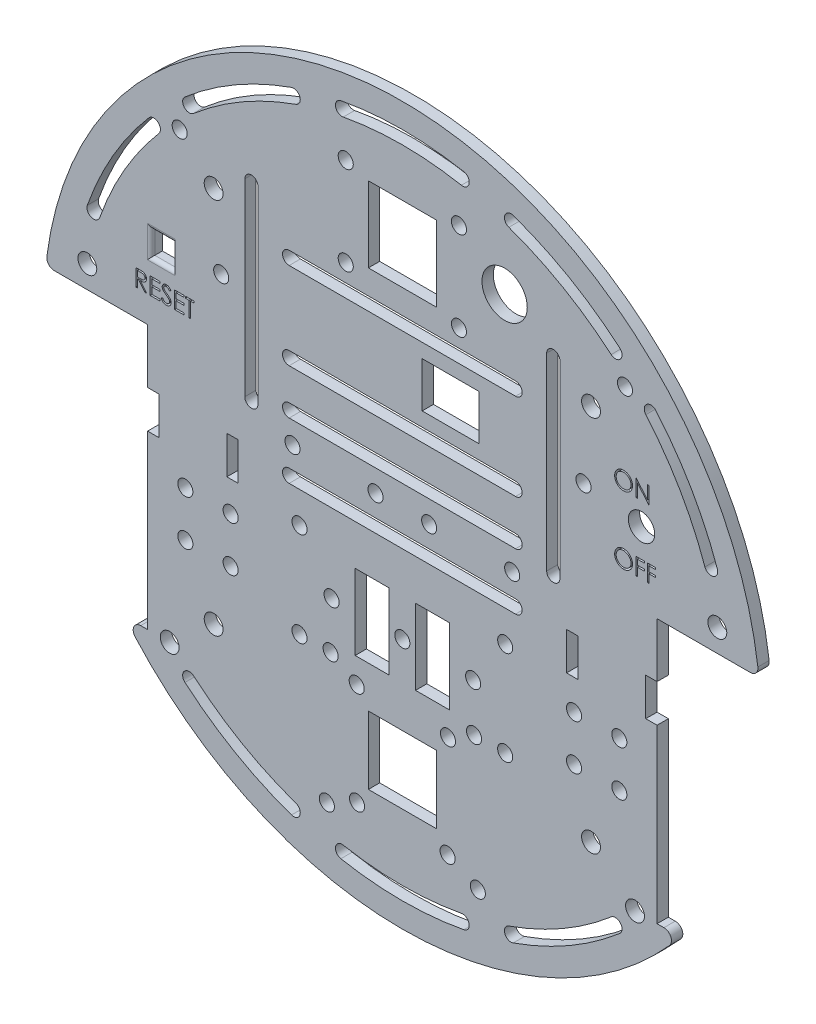
from build123d import *

# Parameters (mm, degrees)
CROQUIS1_R              = 2
CROQUIS1_R_2            = 2.5
CROQUIS1_R_3            = 3.5
CROQUIS1_R_4            = 6
CROQUIS1_W              = 9
CROQUIS1_H              = 20
CROQUIS1_W_2            = 18
CROQUIS1_H_2            = 18
CROQUIS1_W_3            = 3
CROQUIS1_H_3            = 10
CROQUIS1_W_4            = 15
CROQUIS1_H_4            = 12
CROQUIS1_W_5            = 6.4
CROQUIS1_H_5            = 6.4
SALIENTE_EXTRUIR1_DEPTH = 3
REDONDEO2_R             = 2
CORTAR_EXTRUIR2_DEPTH   = 2
REDONDEO3_R             = 1


with BuildPart() as part:
    # Croquis1 → Saliente-Extruir1 (new body)
    with BuildSketch(Plane.XY):
        with BuildLine():
            Line((-73.654599313, -60), (-67.5, -60))
            Line((-67.5, -60), (-67.5, -14.445595459))
            Line((-67.5, -14.445595459), (-64.5, -14.445595459))
            Line((-64.5, -14.445595459), (-64.5, -4.445595459))
            Line((-64.5, -4.445595459), (-67.5, -4.445595459))
            Line((-67.5, -4.445595459), (-67.5, 10))
            Line((-67.5, 10), (-94.472218138, 10))
            ThreePointArc((-94.472218138, 10), (0, 95), (94.472218138, 10))
            Line((94.472218138, 10), (67.5, 10))
            Line((67.5, 10), (67.5, -4.445595459))
            Line((67.5, -4.445595459), (64.5, -4.445595459))
            Line((64.5, -4.445595459), (64.5, -14.445595459))
            Line((64.5, -14.445595459), (67.5, -14.445595459))
            Line((67.5, -14.445595459), (67.5, -60))
            Line((67.5, -60), (73.654599313, -60))
            ThreePointArc((73.654599313, -60), (0, -95), (-73.654599313, -60))
        make_face()
        with Locations((-57.5, -22.445595459)):
            Circle(CROQUIS1_R, mode=Mode.SUBTRACT)
        with Locations((-45.5, -22.445595459)):
            Circle(CROQUIS1_R, mode=Mode.SUBTRACT)
        with Locations(Location((-45.5, -34.445595459, 0), (0, 0, 180))):
            Circle(CROQUIS1_R, mode=Mode.SUBTRACT)
        with Locations(Location((-57.5, -34.445595459, 0), (0, 0, 180))):
            Circle(CROQUIS1_R, mode=Mode.SUBTRACT)
        with Locations((-15, 50.5)):
            Circle(CROQUIS1_R, mode=Mode.SUBTRACT)
        with Locations((-15, 74)):
            Circle(CROQUIS1_R, mode=Mode.SUBTRACT)
        with Locations(Location((45.5, -22.445595459, 0), (0, 0, 180))):
            Circle(CROQUIS1_R, mode=Mode.SUBTRACT)
        with Locations((45.5, -34.445595459)):
            Circle(CROQUIS1_R, mode=Mode.SUBTRACT)
        with Locations((57.5, -34.445595459)):
            Circle(CROQUIS1_R, mode=Mode.SUBTRACT)
        with Locations(Location((57.5, -22.445595459, 0), (0, 0, 180))):
            Circle(CROQUIS1_R, mode=Mode.SUBTRACT)
        with Locations((0, -28.445595459)):
            Circle(CROQUIS1_R, mode=Mode.SUBTRACT)
        with Locations(Location((15, 50.5, 0), (0, 0, 180))):
            Circle(CROQUIS1_R, mode=Mode.SUBTRACT)
        with Locations(Location((15, 74, 0), (0, 0, 180))):
            Circle(CROQUIS1_R, mode=Mode.SUBTRACT)
        with Locations((-50, 50)):
            Circle(CROQUIS1_R_2, mode=Mode.SUBTRACT)
        with Locations((-27.25, -15.945595459)):
            Circle(CROQUIS1_R, mode=Mode.SUBTRACT)
        with Locations(Location((-27.25, -40.945595459, 0), (0, 0, 180))):
            Circle(CROQUIS1_R, mode=Mode.SUBTRACT)
        with Locations((27.25, -40.945595459)):
            Circle(CROQUIS1_R, mode=Mode.SUBTRACT)
        with Locations(Location((27.25, -15.945595459, 0), (0, 0, 180))):
            Circle(CROQUIS1_R, mode=Mode.SUBTRACT)
        with Locations(Location((-50, -50, 0), (0, 0, 180))):
            Circle(CROQUIS1_R_2, mode=Mode.SUBTRACT)
        with Locations((50, -50)):
            Circle(CROQUIS1_R_2, mode=Mode.SUBTRACT)
        with Locations(Location((50, 50, 0), (0, 0, 180))):
            Circle(CROQUIS1_R_2, mode=Mode.SUBTRACT)
        with Locations((63.3826689, 29.044256368)):
            Circle(CROQUIS1_R_3, mode=Mode.SUBTRACT)
        with Locations((-83.472218138, 16)):
            Circle(CROQUIS1_R_2, mode=Mode.SUBTRACT)
        with Locations(Location((83.472218138, 16, 0), (0, 0, 180))):
            Circle(CROQUIS1_R_2, mode=Mode.SUBTRACT)
        with Locations((-61.654599313, -60)):
            Circle(CROQUIS1_R_2, mode=Mode.SUBTRACT)
        with Locations(Location((61.654599313, -60, 0), (0, 0, 180))):
            Circle(CROQUIS1_R_2, mode=Mode.SUBTRACT)
        with Locations((-48, 31.316031132)):
            Circle(CROQUIS1_R, mode=Mode.SUBTRACT)
        with Locations(Location((48, 31.316031132, 0), (0, 0, 180))):
            Circle(CROQUIS1_R, mode=Mode.SUBTRACT)
        with Locations((-20, -75.931306828)):
            Circle(CROQUIS1_R, mode=Mode.SUBTRACT)
        with Locations((-19, -40.945595459)):
            Circle(CROQUIS1_R, mode=Mode.SUBTRACT)
        with Locations(Location((19, -40.945595459, 0), (0, 0, 180))):
            Circle(CROQUIS1_R, mode=Mode.SUBTRACT)
        with Locations(Location((20, -75.931306828, 0), (0, 0, 180))):
            Circle(CROQUIS1_R, mode=Mode.SUBTRACT)
        with Locations((-12, -71.931306828)):
            Circle(CROQUIS1_R, mode=Mode.SUBTRACT)
        with Locations((-12.092592593, -44.931306828)):
            Circle(CROQUIS1_R, mode=Mode.SUBTRACT)
        with Locations(Location((12, -71.931306828, 0), (0, 0, 180))):
            Circle(CROQUIS1_R, mode=Mode.SUBTRACT)
        with Locations(Location((12.092592593, -44.931306828, 0), (0, 0, 180))):
            Circle(CROQUIS1_R, mode=Mode.SUBTRACT)
        with Locations((18.75, -28.445595459)):
            Circle(CROQUIS1_R, mode=Mode.SUBTRACT)
        with Locations(Location((-18.75, -28.445595459, 0), (0, 0, 180))):
            Circle(CROQUIS1_R, mode=Mode.SUBTRACT)
        with Locations((-29.105454469, 1.554404541)):
            Circle(CROQUIS1_R, mode=Mode.SUBTRACT)
        with Locations((-7.105571497, 1.482646437)):
            Circle(CROQUIS1_R, mode=Mode.SUBTRACT)
        with Locations(Location((7.105571497, 1.482646437, 0), (0, 0, 180))):
            Circle(CROQUIS1_R, mode=Mode.SUBTRACT)
        with Locations(Location((29.105454469, 1.554404541, 0), (0, 0, 180))):
            Circle(CROQUIS1_R, mode=Mode.SUBTRACT)
        with Locations((27.101290916, 64.25)):
            Circle(CROQUIS1_R_4, mode=Mode.SUBTRACT)
        with Locations((-59, 59)):
            Circle(CROQUIS1_R, mode=Mode.SUBTRACT)
        with Locations(Location((59, 59, 0), (0, 0, 180))):
            Circle(CROQUIS1_R, mode=Mode.SUBTRACT)
        with Locations((8, -28.445595459)):
            Rectangle(CROQUIS1_W, CROQUIS1_H, mode=Mode.SUBTRACT)
        with Locations((-8, -28.445595459)):
            Rectangle(CROQUIS1_W, CROQUIS1_H, mode=Mode.SUBTRACT)
        with Locations((0, 62.25)):
            Rectangle(CROQUIS1_W_2, CROQUIS1_H, mode=Mode.SUBTRACT)
        with BuildLine():
            Line((-30, -7.695595459), (30, -7.695595459))
            ThreePointArc((30, -7.695595459), (31.75, -5.945595459), (30, -4.195595459))
            Line((30, -4.195595459), (-30, -4.195595459))
            ThreePointArc((-30, -4.195595459), (-31.75, -5.945595459), (-30, -7.695595459))
        make_face(mode=Mode.SUBTRACT)
        with Locations((0, -58.431306828)):
            Rectangle(CROQUIS1_W_2, CROQUIS1_H_2, mode=Mode.SUBTRACT)
        with BuildLine():
            Line((-41.75, 6.316031132), (-41.75, 56.316031132))
            ThreePointArc((-41.75, 56.316031132), (-40, 58.066031132), (-38.25, 56.316031132))
            Line((-38.25, 56.316031132), (-38.25, 6.316031132))
            ThreePointArc((-38.25, 6.316031132), (-40, 4.566031132), (-41.75, 6.316031132))
        make_face(mode=Mode.SUBTRACT)
        with BuildLine():
            Line((41.75, 6.316031132), (41.75, 56.316031132))
            ThreePointArc((41.75, 56.316031132), (40, 58.066031132), (38.25, 56.316031132))
            Line((38.25, 56.316031132), (38.25, 6.316031132))
            ThreePointArc((38.25, 6.316031132), (40, 4.566031132), (41.75, 6.316031132))
        make_face(mode=Mode.SUBTRACT)
        with BuildLine():
            Line((-30, 10.804404541), (30, 10.804404541))
            ThreePointArc((30, 10.804404541), (31.75, 9.054404541), (30, 7.304404541))
            Line((30, 7.304404541), (-30, 7.304404541))
            ThreePointArc((-30, 7.304404541), (-31.75, 9.054404541), (-30, 10.804404541))
        make_face(mode=Mode.SUBTRACT)
        with BuildLine():
            Line((-30, 45.804404541), (30, 45.804404541))
            ThreePointArc((30, 45.804404541), (31.75, 44.054404541), (30, 42.304404541))
            Line((30, 42.304404541), (-30, 42.304404541))
            ThreePointArc((-30, 42.304404541), (-31.75, 44.054404541), (-30, 45.804404541))
        make_face(mode=Mode.SUBTRACT)
        with Locations((-45, -9.445595459)):
            Rectangle(CROQUIS1_W_3, CROQUIS1_H_3, mode=Mode.SUBTRACT)
        with Locations((45, -9.445595459)):
            Rectangle(CROQUIS1_W_3, CROQUIS1_H_3, mode=Mode.SUBTRACT)
        with BuildLine():
            Line((-30, 22.804404541), (30, 22.804404541))
            ThreePointArc((30, 22.804404541), (31.75, 21.054404541), (30, 19.304404541))
            Line((30, 19.304404541), (-30, 19.304404541))
            ThreePointArc((-30, 19.304404541), (-31.75, 21.054404541), (-30, 22.804404541))
        make_face(mode=Mode.SUBTRACT)
        with Locations((12.75, 32.554404541)):
            Rectangle(CROQUIS1_W_4, CROQUIS1_H_4, mode=Mode.SUBTRACT)
        with Locations((-63.3826689, 29.044256368)):
            Rectangle(CROQUIS1_W_5, CROQUIS1_H_5, mode=Mode.SUBTRACT)
        with BuildLine():
            ThreePointArc((-16.298168859, -86.986318992), (0, -88.5), (16.298168859, -86.986318992))
            ThreePointArc((16.298168859, -86.986318992), (17.692755137, -84.943083897), (15.650734057, -83.546720603))
            ThreePointArc((15.650734057, -83.546720603), (0, -85), (-15.650734057, -83.546720603))
            ThreePointArc((-15.650734057, -83.546720603), (-17.692755137, -84.943083897), (-16.298168859, -86.986318992))
        make_face(mode=Mode.SUBTRACT)
        with BuildLine():
            ThreePointArc((-57.607787764, -67.183277599), (-44.25, -76.643248235), (-29.378531229, -83.481446459))
            ThreePointArc((-29.378531229, -83.481446459), (-27.149166537, -82.409246099), (-28.21942702, -80.178949474))
            ThreePointArc((-28.21942702, -80.178949474), (-42.5, -73.612159322), (-55.327293583, -64.528215416))
            ThreePointArc((-55.327293583, -64.528215416), (-57.79391736, -64.716490962), (-57.607787764, -67.183277599))
        make_face(mode=Mode.SUBTRACT)
        with BuildLine():
            ThreePointArc((-67.183277599, 57.607787764), (-76.643248235, 44.25), (-83.481446459, 29.378531229))
            ThreePointArc((-83.481446459, 29.378531229), (-82.409246099, 27.149166537), (-80.178949474, 28.21942702))
            ThreePointArc((-80.178949474, 28.21942702), (-73.612159322, 42.5), (-64.528215416, 55.327293583))
            ThreePointArc((-64.528215416, 55.327293583), (-64.716490962, 57.79391736), (-67.183277599, 57.607787764))
        make_face(mode=Mode.SUBTRACT)
        with BuildLine():
            ThreePointArc((-29.378531229, 83.481446459), (-44.25, 76.643248235), (-57.607787764, 67.183277599))
            ThreePointArc((-57.607787764, 67.183277599), (-57.79391736, 64.716490962), (-55.327293583, 64.528215416))
            ThreePointArc((-55.327293583, 64.528215416), (-42.5, 73.612159322), (-28.21942702, 80.178949474))
            ThreePointArc((-28.21942702, 80.178949474), (-27.149166537, 82.409246099), (-29.378531229, 83.481446459))
        make_face(mode=Mode.SUBTRACT)
        with BuildLine():
            ThreePointArc((57.607787764, 67.183277599), (44.25, 76.643248235), (29.378531229, 83.481446459))
            ThreePointArc((29.378531229, 83.481446459), (27.149166537, 82.409246099), (28.21942702, 80.178949474))
            ThreePointArc((28.21942702, 80.178949474), (42.5, 73.612159322), (55.327293583, 64.528215416))
            ThreePointArc((55.327293583, 64.528215416), (57.79391736, 64.716490962), (57.607787764, 67.183277599))
        make_face(mode=Mode.SUBTRACT)
        with BuildLine():
            ThreePointArc((83.481446459, 29.378531229), (76.643248235, 44.25), (67.183277599, 57.607787764))
            ThreePointArc((67.183277599, 57.607787764), (64.716490962, 57.79391736), (64.528215416, 55.327293583))
            ThreePointArc((64.528215416, 55.327293583), (73.612159322, 42.5), (80.178949474, 28.21942702))
            ThreePointArc((80.178949474, 28.21942702), (82.409246099, 27.149166537), (83.481446459, 29.378531229))
        make_face(mode=Mode.SUBTRACT)
        with BuildLine():
            ThreePointArc((29.378531229, -83.481446459), (44.25, -76.643248235), (57.607787764, -67.183277599))
            ThreePointArc((57.607787764, -67.183277599), (57.79391736, -64.716490962), (55.327293583, -64.528215416))
            ThreePointArc((55.327293583, -64.528215416), (42.5, -73.612159322), (28.21942702, -80.178949474))
            ThreePointArc((28.21942702, -80.178949474), (27.149166537, -82.409246099), (29.378531229, -83.481446459))
        make_face(mode=Mode.SUBTRACT)
        with BuildLine():
            ThreePointArc((-15.650734057, 83.546720603), (0, 85), (15.650734057, 83.546720603))
            ThreePointArc((15.650734057, 83.546720603), (17.692755137, 84.943083897), (16.298168859, 86.986318992))
            ThreePointArc((16.298168859, 86.986318992), (0, 88.5), (-16.298168859, 86.986318992))
            ThreePointArc((-16.298168859, 86.986318992), (-17.692755137, 84.943083897), (-15.650734057, 83.546720603))
        make_face(mode=Mode.SUBTRACT)
    extrude(amount=SALIENTE_EXTRUIR1_DEPTH)

    # Redondeo2
    redondeo2_edges = [part.edges().sort_by_distance(p)[0] for p in [
        (-73.654599313, -60, 1.5),
        (-94.472218138, 10, 1.5),
        (94.472218138, 10, 1.5),
        (73.654599313, -60, 1.5),
    ]]
    fillet(redondeo2_edges, radius=REDONDEO2_R)

    # Croquis2 → Cortar-Extruir2 (cut)
    # profile 1 of 10: a face of its own
    with BuildSketch(Plane.XY.offset(3)):
        with BuildLine():
            add(Edge.make_bspline(
                [(58.598863743, 39.621904175), (58.682188451, 39.619793701), (58.845845051, 39.615648557), (59.08636992, 39.583918281), (59.315992185, 39.529024209), (59.536582364, 39.45591466), (59.745501905, 39.358387593), (59.944323338, 39.240506688), (60.132573604, 39.101036955), (60.307715381, 38.941056521), (60.467988603, 38.76699208), (60.609193313, 38.581234767), (60.727533405, 38.384907735), (60.824715132, 38.178600953), (60.900956201, 37.962780994), (60.9535664, 37.736297276), (60.987172593, 37.500617246), (60.99110145, 37.33986842), (60.993094513, 37.258322444)],
                knots=[0, 0, 0, 0, 1.065120563, 2.091984664, 3.0946048, 4.079830382, 5.057816894, 6.036188127, 7.030412546, 8.04752943, 9.064399622, 10.05169764, 11.02544977, 11.989514704, 12.962713494, 13.945757189, 14.957906945, 16, 16, 16, 16], degree=3))
            add(Edge.make_bspline(
                [(60.993094513, 37.258322444), (60.991101742, 37.177377156), (60.987173761, 37.017824615), (60.95352819, 36.783640187), (60.90076119, 36.558523577), (60.825423133, 36.342850595), (60.728704661, 36.136393728), (60.609576584, 35.939696215), (60.46925217, 35.752693575), (60.309557647, 35.577434434), (60.135470593, 35.4167234), (59.948745964, 35.276684845), (59.753583125, 35.1561824), (59.547470643, 35.060031962), (59.333142024, 34.98318235), (59.108679037, 34.930786111), (58.875133468, 34.896988484), (58.715870748, 34.893107535), (58.634921436, 34.891134944)],
                knots=[0, 0, 0, 0, 1.043624062, 2.057103931, 3.04512605, 4.022047818, 4.998200453, 5.980619268, 6.982898556, 8.009068085, 9.034988726, 10.034168286, 11.015286542, 11.987931943, 12.962482838, 13.94673481, 14.956375938, 16, 16, 16, 16], degree=3))
            add(Edge.make_bspline(
                [(58.634921436, 34.891134944), (58.553375883, 34.893127013), (58.392627891, 34.897053911), (58.156651702, 34.930715717), (57.930008889, 34.983354536), (57.71334758, 35.058580954), (57.506546956, 35.155803108), (57.309202564, 35.274351595), (57.122106518, 35.41501792), (56.946809987, 35.574660659), (56.786418161, 35.748452654), (56.646584677, 35.934668125), (56.528009532, 36.129653712), (56.431113819, 36.333950529), (56.354402371, 36.546570955), (56.302067605, 36.768933283), (56.268207095, 36.999769791), (56.264305149, 37.156939231), (56.262325282, 37.236687829)],
                knots=[0, 0, 0, 0, 1.053102029, 2.075944431, 3.073151272, 4.055350789, 5.033113405, 6.020478099, 7.024410459, 8.052272461, 9.079885166, 10.07527673, 11.055994387, 12.023226415, 12.992069828, 13.970394897, 14.97016774, 16, 16, 16, 16], degree=3))
            add(Edge.make_bspline(
                [(56.262325282, 37.236687829), (56.26301267, 37.290215546), (56.264378776, 37.396595705), (56.280825237, 37.554567048), (56.304690282, 37.709997894), (56.338892741, 37.862446255), (56.383624884, 38.01153895), (56.436406062, 38.158304217), (56.500871578, 38.301254719), (56.573746696, 38.441067651), (56.655083307, 38.57556353), (56.744923556, 38.702694422), (56.840111887, 38.823527132), (56.944464822, 38.934930423), (57.054543108, 39.040145124), (57.172132452, 39.137554332), (57.296515337, 39.228036412), (57.428226968, 39.30957685), (57.564021893, 39.383324309), (57.704006322, 39.446609546), (57.846279057, 39.500925911), (57.991506461, 39.544949829), (58.139302882, 39.579705304), (58.289990891, 39.603371901), (58.443450439, 39.61986031), (58.546836421, 39.621219955), (58.598863743, 39.621904175)],
                knots=[0, 0, 0, 0, 1.037015668, 2.060948919, 3.074880161, 4.083647147, 5.086022904, 6.090072063, 7.104153813, 8.122640571, 9.144368836, 10.147691507, 11.138137339, 12.123020368, 13.103399296, 14.087645067, 15.080126199, 16.082011238, 17.087798457, 18.072939717, 19.057185487, 20.037253025, 21.01195951, 21.997135196, 22.992090687, 24, 24, 24, 24], degree=3))
        make_face()
        with BuildLine():
            add(Edge.make_bspline(
                [(58.618695474, 39.160365713), (58.575990945, 39.15984514), (58.490990146, 39.158808971), (58.364624313, 39.145160193), (58.239920399, 39.125707479), (58.116852647, 39.097959809), (57.995935989, 39.060154599), (57.876043336, 39.01664486), (57.758267982, 38.963646315), (57.642998736, 38.903767123), (57.531250782, 38.837489939), (57.42580588, 38.764240525), (57.326391052, 38.685736669), (57.233249709, 38.601795164), (57.146655345, 38.511988533), (57.064903586, 38.417678258), (56.991271267, 38.316168684), (56.923789811, 38.210212446), (56.863402588, 38.099947556), (56.809704274, 37.986534876), (56.76577912, 37.869049279), (56.729956065, 37.748765362), (56.700256308, 37.625873628), (56.681441263, 37.499441823), (56.667642515, 37.37010525), (56.666665571, 37.282700009), (56.666171436, 37.238490713)],
                knots=[0, 0, 0, 0, 1.008559885, 2.007477868, 2.99961109, 3.989939068, 4.984837346, 5.991145699, 7.001802488, 8.033829008, 9.059044045, 10.069351652, 11.065060232, 12.050310815, 13.029377138, 14.011219647, 14.996725999, 15.989392538, 16.977580475, 17.965360261, 18.951710183, 19.937753436, 20.929683414, 21.935841486, 22.955955122, 24, 24, 24, 24], degree=3))
            add(Edge.make_bspline(
                [(56.666171436, 37.238490713), (56.667810544, 37.173482144), (56.671035177, 37.045590176), (56.699266338, 36.858173991), (56.742751734, 36.67806048), (56.806854062, 36.506235168), (56.887019138, 36.34122109), (56.986053712, 36.184482099), (57.103386822, 36.035975832), (57.236668499, 35.896739057), (57.382369121, 35.769651595), (57.537082631, 35.658098641), (57.699151555, 35.563714034), (57.86899853, 35.486821798), (58.045716795, 35.425892135), (58.230445075, 35.384133895), (58.421952808, 35.356651167), (58.552492222, 35.354011909), (58.618695474, 35.352673406)],
                knots=[0, 0, 0, 0, 1.032063989, 2.030389145, 3.003944642, 3.970395727, 4.937377036, 5.913328081, 6.909231446, 7.93887556, 8.970685674, 9.976071282, 10.964166581, 11.944589148, 12.933237628, 13.927779006, 14.949070134, 16, 16, 16, 16], degree=3))
            add(Edge.make_bspline(
                [(58.618695474, 35.352673406), (58.663193405, 35.353284768), (58.751446166, 35.354497284), (58.882711837, 35.366709869), (59.011612681, 35.386293701), (59.137967898, 35.414490258), (59.261634084, 35.449779524), (59.383127402, 35.491703745), (59.501153776, 35.54400815), (59.617202139, 35.601798374), (59.728283021, 35.667678576), (59.834322991, 35.738441911), (59.932649251, 35.816830138), (60.025720914, 35.899524468), (60.1126708, 35.988192273), (60.192910922, 36.082718272), (60.266171092, 36.183699117), (60.333626924, 36.289494639), (60.393802547, 36.40006125), (60.446232817, 36.513885121), (60.490713538, 36.630685976), (60.526621615, 36.750632282), (60.554760066, 36.873496231), (60.574148535, 36.999442331), (60.587710813, 37.128218629), (60.588733055, 37.215317872), (60.589248359, 37.259223886)],
                knots=[0, 0, 0, 0, 1.047197238, 2.076906641, 3.100256066, 4.114471768, 5.12198147, 6.126382909, 7.136867548, 8.15857795, 9.17633901, 10.174870724, 11.156907918, 12.133735059, 13.104061851, 14.077631395, 15.04955518, 16.038496417, 17.029181396, 18.010275684, 18.986308667, 19.968651475, 20.955262928, 21.950658345, 22.966943676, 24, 24, 24, 24], degree=3))
            add(Edge.make_bspline(
                [(60.589248359, 37.259223886), (60.588732642, 37.302829535), (60.587709623, 37.389329371), (60.574155013, 37.517207566), (60.554739582, 37.642247409), (60.526758958, 37.763958013), (60.490694474, 37.882370402), (60.44622505, 37.997373364), (60.393786807, 38.109395329), (60.333604805, 38.218159425), (60.265955889, 38.322526945), (60.192034719, 38.422301476), (60.110564985, 38.515609286), (60.023874382, 38.604753892), (59.929797529, 38.687834036), (59.82876058, 38.764877277), (59.721990137, 38.837742915), (59.608940834, 38.903475781), (59.492270037, 38.964179794), (59.372552091, 39.016188227), (59.251143248, 39.060380952), (59.128352247, 39.098074192), (59.00314556, 39.125598803), (58.876369209, 39.145177724), (58.748198591, 39.15880422), (58.662000165, 39.159843564), (58.618695474, 39.160365713)],
                knots=[0, 0, 0, 0, 1.02996197, 2.043119294, 3.035359645, 4.018872909, 4.991431989, 5.957985074, 6.929999688, 7.912076566, 8.892894881, 9.867085534, 10.843653904, 11.817741046, 12.803660682, 13.806313499, 14.818574707, 15.856120519, 16.894564902, 17.924820532, 18.937903209, 19.946497019, 20.957711757, 21.963978472, 22.977135795, 24, 24, 24, 24], degree=3))
        make_face(mode=Mode.SUBTRACT)
    # profile 2 of 10: a face of its own
    with BuildSketch(Plane.XY.offset(3)):
        Polygon((61.916171436, 35.00651956), (61.916171436, 39.50651956), (62.000907013, 39.50651956), (64.973863743, 35.964752733), (64.973863743, 39.50651956), (65.377709897, 39.50651956), (65.377709897, 35.00651956), (65.285762782, 35.00651956), (62.32001759, 38.540173406), (62.32001759, 35.00651956), align=None)
    # profile 3 of 10: a face of its own
    with BuildSketch(Plane.XY.offset(3)):
        with BuildLine():
            Line((-70.609873728, 21.523755649), (-69.709332863, 21.523755649))
            add(Edge.make_bspline(
                [(-69.709332863, 21.523755649), (-69.649237126, 21.52355561), (-69.533846654, 21.523171512), (-69.368538164, 21.521029817), (-69.218331896, 21.51489136), (-69.083306389, 21.509608895), (-68.963464118, 21.499976399), (-68.858437601, 21.490769853), (-68.768710562, 21.478718004), (-68.714394467, 21.467525317), (-68.689801613, 21.462457572)],
                knots=[0, 0, 0, 0, 1.410062039, 2.707475311, 3.878576406, 4.937260626, 5.877586885, 6.699081471, 7.410979367, 8, 8, 8, 8], degree=3))
            add(Edge.make_bspline(
                [(-68.689801613, 21.462457572), (-68.65687881, 21.454323159), (-68.591735538, 21.438227863), (-68.497942596, 21.404208376), (-68.408567036, 21.364840288), (-68.323980119, 21.318601219), (-68.244605531, 21.26514793), (-68.169624846, 21.205403202), (-68.098697821, 21.139693937), (-68.034692868, 21.066363427), (-67.974342659, 20.989430771), (-67.923442996, 20.906240227), (-67.879566094, 20.819246834), (-67.844632572, 20.727565869), (-67.816503749, 20.632086448), (-67.796670012, 20.531943709), (-67.784775628, 20.427593884), (-67.783564671, 20.35641943), (-67.782950651, 20.320330168)],
                knots=[0, 0, 0, 0, 1.027469482, 2.033020251, 3.019912614, 3.986113645, 4.951240523, 5.91722682, 6.890402269, 7.87763091, 8.8651537, 9.85103654, 10.82876324, 11.815024772, 12.821070561, 13.842952187, 14.906261191, 16, 16, 16, 16], degree=3))
            add(Edge.make_bspline(
                [(-67.782950651, 20.320330168), (-67.784839363, 20.260370748), (-67.788524729, 20.143374389), (-67.822885576, 19.973581827), (-67.879169673, 19.815195566), (-67.956728188, 19.668415031), (-68.055496085, 19.536101344), (-68.174199388, 19.419885045), (-68.312904317, 19.322633728), (-68.442027723, 19.255194408), (-68.556088837, 19.212003526), (-68.649988811, 19.181613921), (-68.752417782, 19.158134252), (-68.862394355, 19.137099797), (-68.980376198, 19.121219047), (-69.106080534, 19.109587711), (-69.239597015, 19.10231822), (-69.331318675, 19.101235642), (-69.378503536, 19.100678726)],
                knots=[0, 0, 0, 0, 1.260483769, 2.459530307, 3.627416485, 4.787058657, 5.939039949, 7.08810263, 8.267026773, 9.491475466, 10.141966685, 10.831826277, 11.566392101, 12.351337768, 13.187381173, 14.07005841, 15.007169909, 16, 16, 16, 16], degree=3))
            Line((-69.378503536, 19.100678726), (-67.725258343, 17.023755649))
            Line((-67.725258343, 17.023755649), (-68.224657382, 17.023755649))
            Line((-68.224657382, 17.023755649), (-69.877902574, 19.100678726))
            Line((-69.877902574, 19.100678726), (-70.206027574, 19.100678726))
            Line((-70.206027574, 19.100678726), (-70.206027574, 17.023755649))
            Line((-70.206027574, 17.023755649), (-70.609873728, 17.023755649))
            Line((-70.609873728, 17.023755649), (-70.609873728, 21.523755649))
        make_face()
        with BuildLine():
            Line((-70.206027574, 21.062217187), (-70.206027574, 19.562217187))
            Line((-70.206027574, 19.562217187), (-69.382109305, 19.555907091))
            add(Edge.make_bspline(
                [(-69.382109305, 19.555907091), (-69.343640683, 19.555890073), (-69.269077539, 19.555857086), (-69.161205255, 19.560991941), (-69.060765112, 19.56683335), (-68.968141287, 19.575768223), (-68.883292405, 19.587283172), (-68.806260874, 19.601687009), (-68.73692095, 19.618468233), (-68.6560514, 19.644441752), (-68.565747289, 19.685592346), (-68.46760684, 19.745462273), (-68.384032406, 19.820765427), (-68.313423726, 19.906874156), (-68.256685885, 20.001549333), (-68.216684673, 20.103656093), (-68.191301532, 20.210616719), (-68.188307688, 20.284131429), (-68.186796805, 20.32123161)],
                knots=[0, 0, 0, 0, 1.146690395, 2.22261258, 3.21895312, 4.145990853, 4.996080663, 5.770904154, 6.481378293, 7.121626537, 8.300444488, 9.431385265, 10.535395872, 11.636531494, 12.74115979, 13.810798291, 14.895190096, 16, 16, 16, 16], degree=3))
            add(Edge.make_bspline(
                [(-68.186796805, 20.32123161), (-68.188342389, 20.357420062), (-68.191405173, 20.429132369), (-68.216410733, 20.53411854), (-68.25869708, 20.633204618), (-68.315682815, 20.725987528), (-68.3851103, 20.810209188), (-68.466518916, 20.882269813), (-68.557682738, 20.941733411), (-68.642888565, 20.9797319), (-68.719046838, 21.003028854), (-68.785170686, 21.019423208), (-68.859885444, 21.032594668), (-68.94355389, 21.043147889), (-69.035818844, 21.052218531), (-69.137146824, 21.058327961), (-69.246865542, 21.061945786), (-69.322911596, 21.062124615), (-69.362277574, 21.062217187)],
                knots=[0, 0, 0, 0, 1.101028733, 2.181837193, 3.264309656, 4.369019818, 5.486613113, 6.575447106, 7.666700264, 8.788928104, 9.402425223, 10.0903467, 10.862060571, 11.710948788, 12.657782767, 13.684531032, 14.801375019, 16, 16, 16, 16], degree=3))
            Line((-69.362277574, 21.062217187), (-70.206027574, 21.062217187))
        make_face(mode=Mode.SUBTRACT)
    # profile 4 of 10: a face of its own
    with BuildSketch(Plane.XY.offset(3)):
        Polygon((-66.80218142, 21.523755649), (-64.263719882, 21.523755649), (-64.263719882, 21.062217187), (-66.398335266, 21.062217187), (-66.398335266, 19.677601803), (-64.263719882, 19.677601803), (-64.263719882, 19.216063341), (-66.398335266, 19.216063341), (-66.398335266, 17.48529411), (-64.263719882, 17.48529411), (-64.263719882, 17.023755649), (-66.80218142, 17.023755649), align=None)
    # profile 5 of 10: a face of its own
    with BuildSketch(Plane.XY.offset(3)):
        with BuildLine():
            Line((-63.917566036, 17.891844591), (-63.537157382, 18.119909495))
            add(Edge.make_bspline(
                [(-63.537157382, 18.119909495), (-63.501776791, 18.060683857), (-63.433988944, 17.947209821), (-63.320908626, 17.793878055), (-63.20373774, 17.663555282), (-63.081608597, 17.556999643), (-62.955266663, 17.473108217), (-62.823887166, 17.413705348), (-62.687912838, 17.376656237), (-62.595375067, 17.372156126), (-62.549176613, 17.369909495)],
                knots=[0, 0, 0, 0, 1.272034388, 2.437168799, 3.508375237, 4.49857839, 5.41946034, 6.295179144, 7.148887113, 8, 8, 8, 8], degree=3))
            add(Edge.make_bspline(
                [(-62.549176613, 17.369909495), (-62.509722078, 17.37100836), (-62.431503369, 17.373186861), (-62.316351914, 17.394119321), (-62.204518168, 17.426277773), (-62.098307063, 17.472333256), (-61.99918413, 17.528054166), (-61.912261236, 17.595356394), (-61.837116233, 17.67070723), (-61.775647372, 17.754770644), (-61.728487326, 17.845178406), (-61.692240381, 17.937976058), (-61.672125286, 18.03462136), (-61.669095175, 18.099691955), (-61.667566036, 18.132529687)],
                knots=[0, 0, 0, 0, 1.095163259, 2.171163733, 3.241058638, 4.321873601, 5.38011039, 6.391990106, 7.366004449, 8.327778327, 9.272591725, 10.192022065, 11.087607919, 12, 12, 12, 12], degree=3))
            add(Edge.make_bspline(
                [(-61.667566036, 18.132529687), (-61.669461578, 18.169996494), (-61.673314938, 18.246161037), (-61.705883984, 18.35853202), (-61.75711873, 18.469736753), (-61.804384986, 18.538524094), (-61.828924209, 18.574236418)],
                knots=[0, 0, 0, 0, 0.938893495, 1.908633276, 2.914225137, 4, 4, 4, 4], degree=3))
            add(Edge.make_bspline(
                [(-61.828924209, 18.574236418), (-61.849072141, 18.600010906), (-61.891370205, 18.654121218), (-61.964087007, 18.734665092), (-62.049414868, 18.817745917), (-62.144433725, 18.906536133), (-62.252604839, 18.996906157), (-62.370540215, 19.093165371), (-62.50125089, 19.191653113), (-62.592921672, 19.257703555), (-62.640222286, 19.291784495)],
                knots=[0, 0, 0, 0, 0.722233717, 1.516239348, 2.393582979, 3.351407094, 4.387010283, 5.505090956, 6.712668013, 8, 8, 8, 8], degree=3))
            add(Edge.make_bspline(
                [(-62.640222286, 19.291784495), (-62.687567424, 19.325506965), (-62.778087722, 19.389981759), (-62.904677328, 19.485670124), (-63.017877352, 19.573155099), (-63.117184659, 19.653260258), (-63.202555569, 19.725996464), (-63.274662812, 19.790665243), (-63.331669528, 19.849015535), (-63.36336956, 19.886868689), (-63.377602093, 19.903863822)],
                knots=[0, 0, 0, 0, 1.452282411, 2.77665338, 3.964542531, 5.026858415, 5.96415736, 6.766646006, 7.446254459, 8, 8, 8, 8], degree=3))
            add(Edge.make_bspline(
                [(-63.377602093, 19.903863822), (-63.397495366, 19.930350869), (-63.436618156, 19.982441203), (-63.488260163, 20.063858877), (-63.532153372, 20.147203075), (-63.566562085, 20.232697758), (-63.595537223, 20.319142667), (-63.615025991, 20.407665697), (-63.627229216, 20.497869635), (-63.628478913, 20.558572707), (-63.629104497, 20.588959976)],
                knots=[0, 0, 0, 0, 1.068054152, 2.10047183, 3.106115577, 4.101338837, 5.06977816, 6.043150881, 7.020423561, 8, 8, 8, 8], degree=3))
            add(Edge.make_bspline(
                [(-63.629104497, 20.588959976), (-63.627426371, 20.636569686), (-63.624105988, 20.730771482), (-63.596025323, 20.86838255), (-63.551703031, 20.999765086), (-63.489609604, 21.123618373), (-63.409564436, 21.236717491), (-63.316933898, 21.340363403), (-63.206604844, 21.427494437), (-63.085551471, 21.503624226), (-62.953050421, 21.563211844), (-62.814204974, 21.608161676), (-62.668794453, 21.633630722), (-62.570304708, 21.637285705), (-62.520330459, 21.639140264)],
                knots=[0, 0, 0, 0, 1.005424448, 1.989358655, 2.955360095, 3.929531133, 4.905563448, 5.876582895, 6.856512386, 7.866279853, 8.892233794, 9.918561126, 10.94386622, 12, 12, 12, 12], degree=3))
            add(Edge.make_bspline(
                [(-62.520330459, 21.639140264), (-62.46730233, 21.637311269), (-62.361846306, 21.633673982), (-62.206725886, 21.602048585), (-62.057376394, 21.54971915), (-61.937235053, 21.490333732), (-61.843207217, 21.431021912), (-61.771499418, 21.376996424), (-61.698834124, 21.314799855), (-61.624625196, 21.244266539), (-61.550130063, 21.164749288), (-61.474242767, 21.076792688), (-61.39678585, 20.980934259), (-61.346956887, 20.912502758), (-61.321412189, 20.877421514)],
                knots=[0, 0, 0, 0, 1.286793592, 2.559021753, 3.825965368, 5.121522368, 5.803751409, 6.523245864, 7.299691795, 8.125521123, 9.008227632, 9.944561021, 10.946284179, 12, 12, 12, 12], degree=3))
            Line((-61.321412189, 20.877421514), (-61.686496324, 20.600678726))
            add(Edge.make_bspline(
                [(-61.686496324, 20.600678726), (-61.708541094, 20.629078471), (-61.750994168, 20.683769739), (-61.815446365, 20.760361431), (-61.876194627, 20.830325476), (-61.936045141, 20.891094926), (-61.991836953, 20.945997669), (-62.045987436, 20.99300307), (-62.097717316, 21.032571693), (-62.162924772, 21.074799127), (-62.244847553, 21.116657489), (-62.347684814, 21.152077732), (-62.455152882, 21.173362812), (-62.528348122, 21.176177096), (-62.565402574, 21.177601803)],
                knots=[0, 0, 0, 0, 1.181633172, 2.275549214, 3.290209073, 4.226197932, 5.078386478, 5.862611352, 6.581680152, 7.217281963, 8.414376989, 9.595101626, 10.782541182, 12, 12, 12, 12], degree=3))
            add(Edge.make_bspline(
                [(-62.565402574, 21.177601803), (-62.611889531, 21.176043903), (-62.70153525, 21.173039639), (-62.82880841, 21.14022823), (-62.943357742, 21.088565838), (-63.041782469, 21.016160866), (-63.123730011, 20.930376733), (-63.183008458, 20.831661062), (-63.218687241, 20.722655116), (-63.223041029, 20.646615843), (-63.225258343, 20.607890264)],
                knots=[0, 0, 0, 0, 1.14458467, 2.207223713, 3.21896685, 4.227309161, 5.202851033, 6.127160689, 7.046193047, 8, 8, 8, 8], degree=3))
            add(Edge.make_bspline(
                [(-63.225258343, 20.607890264), (-63.224752895, 20.58378122), (-63.223741171, 20.53552371), (-63.209630717, 20.464229024), (-63.191503008, 20.393114445), (-63.162776768, 20.322499696), (-63.12311852, 20.251149806), (-63.071040437, 20.177836143), (-63.005451893, 20.101912517), (-62.95521002, 20.052531608), (-62.928683824, 20.026459976)],
                knots=[0, 0, 0, 0, 0.858281714, 1.717966888, 2.583508476, 3.4729293, 4.427298488, 5.488583878, 6.674047936, 8, 8, 8, 8], degree=3))
            add(Edge.make_bspline(
                [(-62.928683824, 20.026459976), (-62.918833488, 20.017669514), (-62.895431345, 19.996785389), (-62.852648012, 19.962595314), (-62.796150128, 19.920420321), (-62.727413012, 19.868236628), (-62.645169262, 19.80770332), (-62.549409832, 19.73959439), (-62.441202147, 19.6616988), (-62.364416827, 19.607239105), (-62.323816036, 19.578443149)],
                knots=[0, 0, 0, 0, 0.420754252, 0.999615792, 1.744751191, 2.668019286, 3.750313428, 4.999500688, 6.413464383, 8, 8, 8, 8], degree=3))
            add(Edge.make_bspline(
                [(-62.323816036, 19.578443149), (-62.274977004, 19.542904258), (-62.180406989, 19.474088121), (-62.045847243, 19.370696533), (-61.923840919, 19.269577973), (-61.813959657, 19.171378193), (-61.715117917, 19.076842073), (-61.628412277, 18.98483227), (-61.552959259, 18.896007962), (-61.471728835, 18.782128936), (-61.388725924, 18.642267542), (-61.317443986, 18.470909807), (-61.27249754, 18.298885966), (-61.266619877, 18.183265748), (-61.263719882, 18.126219591)],
                knots=[0, 0, 0, 0, 1.163667725, 2.253281268, 3.268753668, 4.215851969, 5.092017293, 5.902905408, 6.650798638, 7.335211899, 8.59617414, 9.77448103, 10.901945474, 12, 12, 12, 12], degree=3))
            add(Edge.make_bspline(
                [(-61.263719882, 18.126219591), (-61.264564774, 18.085875979), (-61.26623815, 18.0059722), (-61.285473611, 17.888644244), (-61.313656037, 17.774690269), (-61.356132481, 17.665518838), (-61.407976542, 17.559132715), (-61.473761717, 17.458322557), (-61.550014455, 17.360857188), (-61.637486438, 17.269335556), (-61.733202599, 17.185319018), (-61.834367349, 17.110581654), (-61.941146271, 17.048265238), (-62.052960107, 16.997414155), (-62.16983454, 16.95764249), (-62.291730262, 16.928825944), (-62.418848205, 16.91114003), (-62.505248824, 16.909304336), (-62.549176613, 16.908371033)],
                knots=[0, 0, 0, 0, 0.983748083, 1.948392443, 2.894712957, 3.844097841, 4.80183111, 5.778335162, 6.776009319, 7.81870978, 8.863265674, 9.881300176, 10.883814829, 11.87499822, 12.874611388, 13.892143829, 14.928324115, 16, 16, 16, 16], degree=3))
            add(Edge.make_bspline(
                [(-62.549176613, 16.908371033), (-62.583164911, 16.909028267), (-62.650713459, 16.910334457), (-62.75062565, 16.921881817), (-62.848519408, 16.938219522), (-62.943166342, 16.964157612), (-63.035785871, 16.995628011), (-63.125975173, 17.034377296), (-63.213777956, 17.080813698), (-63.299686277, 17.133907301), (-63.383481644, 17.195695829), (-63.464378103, 17.267661753), (-63.545029913, 17.34782026), (-63.623056565, 17.438348127), (-63.700036322, 17.537782805), (-63.77445142, 17.647054612), (-63.8478422, 17.765568353), (-63.893890659, 17.84896632), (-63.917566036, 17.891844591)],
                knots=[0, 0, 0, 0, 0.915332311, 1.819136955, 2.706846663, 3.586547465, 4.459518054, 5.340707479, 6.227863349, 7.133153174, 8.059268498, 9.028702269, 10.047606654, 11.120612155, 12.245963614, 13.433783089, 14.680604001, 16, 16, 16, 16], degree=3))
        make_face()
    # profile 6 of 10: a face of its own
    with BuildSketch(Plane.XY.offset(3)):
        Polygon((-60.340642959, 21.523755649), (-57.80218142, 21.523755649), (-57.80218142, 21.062217187), (-59.936796805, 21.062217187), (-59.936796805, 19.677601803), (-57.80218142, 19.677601803), (-57.80218142, 19.216063341), (-59.936796805, 19.216063341), (-59.936796805, 17.48529411), (-57.80218142, 17.48529411), (-57.80218142, 17.023755649), (-60.340642959, 17.023755649), align=None)
    # profile 7 of 10: a face of its own
    with BuildSketch(Plane.XY.offset(3)):
        Polygon((-57.513719882, 21.062217187), (-57.513719882, 21.523755649), (-55.148335266, 21.523755649), (-55.148335266, 21.062217187), (-56.129104497, 21.062217187), (-56.129104497, 17.023755649), (-56.532950651, 17.023755649), (-56.532950651, 21.062217187), align=None)
    # profile 8 of 10: a face of its own
    with BuildSketch(Plane.XY.offset(3)):
        with BuildLine():
            add(Edge.make_bspline(
                [(58.598863743, 21.639140264), (58.682188451, 21.637029791), (58.845845051, 21.632884647), (59.08636992, 21.601154371), (59.315992185, 21.546260298), (59.536582364, 21.473150749), (59.745501905, 21.375623682), (59.944323338, 21.257742777), (60.132573604, 21.118273044), (60.307715381, 20.95829261), (60.467988603, 20.784228169), (60.609193313, 20.598470856), (60.727533405, 20.402143825), (60.824715132, 20.195837042), (60.900956201, 19.980017084), (60.9535664, 19.753533366), (60.987172593, 19.517853336), (60.99110145, 19.35710451), (60.993094513, 19.275558533)],
                knots=[0, 0, 0, 0, 1.065120563, 2.091984664, 3.0946048, 4.079830382, 5.057816894, 6.036188127, 7.030412546, 8.04752943, 9.064399622, 10.05169764, 11.02544977, 11.989514704, 12.962713494, 13.945757189, 14.957906945, 16, 16, 16, 16], degree=3))
            add(Edge.make_bspline(
                [(60.993094513, 19.275558533), (60.991101742, 19.194613245), (60.987173761, 19.035060705), (60.95352819, 18.800876277), (60.90076119, 18.575759667), (60.825423133, 18.360086685), (60.728704661, 18.153629817), (60.609576584, 17.956932305), (60.46925217, 17.769929664), (60.309557647, 17.594670523), (60.135470593, 17.433959489), (59.948745964, 17.293920935), (59.753583125, 17.173418489), (59.547470643, 17.077268051), (59.333142024, 17.000418439), (59.108679037, 16.9480222), (58.875133468, 16.914224573), (58.715870748, 16.910343624), (58.634921436, 16.908371033)],
                knots=[0, 0, 0, 0, 1.043624062, 2.057103931, 3.04512605, 4.022047818, 4.998200453, 5.980619268, 6.982898556, 8.009068085, 9.034988726, 10.034168286, 11.015286542, 11.987931943, 12.962482838, 13.94673481, 14.956375938, 16, 16, 16, 16], degree=3))
            add(Edge.make_bspline(
                [(58.634921436, 16.908371033), (58.553375883, 16.910363102), (58.392627891, 16.91429), (58.156651702, 16.947951806), (57.930008889, 17.000590626), (57.71334758, 17.075817044), (57.506546956, 17.173039197), (57.309202564, 17.291587685), (57.122106518, 17.432254009), (56.946809987, 17.591896748), (56.786418161, 17.765688743), (56.646584677, 17.951904214), (56.528009532, 18.146889801), (56.431113819, 18.351186618), (56.354402371, 18.563807044), (56.302067605, 18.786169372), (56.268207095, 19.01700588), (56.264305149, 19.174175321), (56.262325282, 19.253923918)],
                knots=[0, 0, 0, 0, 1.053102029, 2.075944431, 3.073151272, 4.055350789, 5.033113405, 6.020478099, 7.024410459, 8.052272461, 9.079885166, 10.07527673, 11.055994387, 12.023226415, 12.992069828, 13.970394897, 14.97016774, 16, 16, 16, 16], degree=3))
            add(Edge.make_bspline(
                [(56.262325282, 19.253923918), (56.26301267, 19.307451636), (56.264378776, 19.413831794), (56.280825237, 19.571803137), (56.304690282, 19.727233983), (56.338892741, 19.879682345), (56.383624884, 20.028775039), (56.436406062, 20.175540306), (56.500871578, 20.318490808), (56.573746696, 20.45830374), (56.655083307, 20.592799619), (56.744923556, 20.719930512), (56.840111887, 20.840763222), (56.944464822, 20.952166512), (57.054543108, 21.057381213), (57.172132452, 21.154790421), (57.296515337, 21.245272501), (57.428226968, 21.326812939), (57.564021893, 21.400560398), (57.704006322, 21.463845635), (57.846279057, 21.518162), (57.991506461, 21.562185918), (58.139302882, 21.596941393), (58.289990891, 21.620607991), (58.443450439, 21.637096399), (58.546836421, 21.638456045), (58.598863743, 21.639140264)],
                knots=[0, 0, 0, 0, 1.037015668, 2.060948919, 3.074880161, 4.083647147, 5.086022904, 6.090072063, 7.104153813, 8.122640571, 9.144368836, 10.147691507, 11.138137339, 12.123020368, 13.103399296, 14.087645067, 15.080126199, 16.082011238, 17.087798457, 18.072939717, 19.057185487, 20.037253025, 21.01195951, 21.997135196, 22.992090687, 24, 24, 24, 24], degree=3))
        make_face()
        with BuildLine():
            add(Edge.make_bspline(
                [(58.618695474, 21.177601803), (58.575990945, 21.17708123), (58.490990146, 21.17604506), (58.364624313, 21.162396283), (58.239920399, 21.142943568), (58.116852647, 21.115195899), (57.995935989, 21.077390688), (57.876043336, 21.033880949), (57.758267982, 20.980882404), (57.642998736, 20.921003213), (57.531250782, 20.854726029), (57.42580588, 20.781476614), (57.326391052, 20.702972758), (57.233249709, 20.619031253), (57.146655345, 20.529224622), (57.064903586, 20.434914347), (56.991271267, 20.333404773), (56.923789811, 20.227448536), (56.863402588, 20.117183646), (56.809704274, 20.003770966), (56.76577912, 19.886285368), (56.729956065, 19.766001451), (56.700256308, 19.643109718), (56.681441263, 19.516677912), (56.667642515, 19.387341339), (56.666665571, 19.299936098), (56.666171436, 19.255726803)],
                knots=[0, 0, 0, 0, 1.008559885, 2.007477868, 2.99961109, 3.989939068, 4.984837346, 5.991145699, 7.001802488, 8.033829008, 9.059044045, 10.069351652, 11.065060232, 12.050310815, 13.029377138, 14.011219647, 14.996725999, 15.989392538, 16.977580475, 17.965360261, 18.951710183, 19.937753436, 20.929683414, 21.935841486, 22.955955122, 24, 24, 24, 24], degree=3))
            add(Edge.make_bspline(
                [(56.666171436, 19.255726803), (56.667810544, 19.190718233), (56.671035177, 19.062826266), (56.699266338, 18.875410081), (56.742751734, 18.69529657), (56.806854062, 18.523471258), (56.887019138, 18.35845718), (56.986053712, 18.201718188), (57.103386822, 18.053211921), (57.236668499, 17.913975147), (57.382369121, 17.786887684), (57.537082631, 17.67533473), (57.699151555, 17.580950123), (57.86899853, 17.504057887), (58.045716795, 17.443128224), (58.230445075, 17.401369984), (58.421952808, 17.373887256), (58.552492222, 17.371247998), (58.618695474, 17.369909495)],
                knots=[0, 0, 0, 0, 1.032063989, 2.030389145, 3.003944642, 3.970395727, 4.937377036, 5.913328081, 6.909231446, 7.93887556, 8.970685674, 9.976071282, 10.964166581, 11.944589148, 12.933237628, 13.927779006, 14.949070134, 16, 16, 16, 16], degree=3))
            add(Edge.make_bspline(
                [(58.618695474, 17.369909495), (58.663193405, 17.370520858), (58.751446166, 17.371733374), (58.882711837, 17.383945958), (59.011612681, 17.40352979), (59.137967898, 17.431726348), (59.261634084, 17.467015613), (59.383127402, 17.508939835), (59.501153776, 17.561244239), (59.617202139, 17.619034463), (59.728283021, 17.684914665), (59.834322991, 17.755678001), (59.932649251, 17.834066227), (60.025720914, 17.916760558), (60.1126708, 18.005428362), (60.192910922, 18.099954362), (60.266171092, 18.200935207), (60.333626924, 18.306730728), (60.393802547, 18.417297339), (60.446232817, 18.531121211), (60.490713538, 18.647922065), (60.526621615, 18.767868372), (60.554760066, 18.89073232), (60.574148535, 19.016678421), (60.587710813, 19.145454718), (60.588733055, 19.232553961), (60.589248359, 19.276459976)],
                knots=[0, 0, 0, 0, 1.047197238, 2.076906641, 3.100256066, 4.114471768, 5.12198147, 6.126382909, 7.136867548, 8.15857795, 9.17633901, 10.174870724, 11.156907918, 12.133735059, 13.104061851, 14.077631395, 15.04955518, 16.038496417, 17.029181396, 18.010275684, 18.986308667, 19.968651475, 20.955262928, 21.950658345, 22.966943676, 24, 24, 24, 24], degree=3))
            add(Edge.make_bspline(
                [(60.589248359, 19.276459976), (60.588732642, 19.320065624), (60.587709623, 19.40656546), (60.574155013, 19.534443655), (60.554739582, 19.659483498), (60.526758958, 19.781194102), (60.490694474, 19.899606492), (60.44622505, 20.014609453), (60.393786807, 20.126631418), (60.333604805, 20.235395514), (60.265955889, 20.339763034), (60.192034719, 20.439537565), (60.110564985, 20.532845375), (60.023874382, 20.621989982), (59.929797529, 20.705070126), (59.82876058, 20.782113366), (59.721990137, 20.854979005), (59.608940834, 20.92071187), (59.492270037, 20.981415883), (59.372552091, 21.033424316), (59.251143248, 21.077617041), (59.128352247, 21.115310282), (59.00314556, 21.142834892), (58.876369209, 21.162413813), (58.748198591, 21.176040309), (58.662000165, 21.177079653), (58.618695474, 21.177601803)],
                knots=[0, 0, 0, 0, 1.02996197, 2.043119294, 3.035359645, 4.018872909, 4.991431989, 5.957985074, 6.929999688, 7.912076566, 8.892894881, 9.867085534, 10.843653904, 11.817741046, 12.803660682, 13.806313499, 14.818574707, 15.856120519, 16.894564902, 17.924820532, 18.937903209, 19.946497019, 20.957711757, 21.963978472, 22.977135795, 24, 24, 24, 24], degree=3))
        make_face(mode=Mode.SUBTRACT)
    # profile 9 of 10: a face of its own
    with BuildSketch(Plane.XY.offset(3)):
        Polygon((61.916171436, 21.523755649), (64.108479128, 21.523755649), (64.108479128, 21.062217187), (62.32001759, 21.062217187), (62.32001759, 19.677601803), (64.108479128, 19.677601803), (64.108479128, 19.216063341), (62.32001759, 19.216063341), (62.32001759, 17.023755649), (61.916171436, 17.023755649), align=None)
    # profile 10 of 10: a face of its own
    with BuildSketch(Plane.XY.offset(3)):
        Polygon((64.916171436, 21.523755649), (67.108479128, 21.523755649), (67.108479128, 21.062217187), (65.32001759, 21.062217187), (65.32001759, 19.677601803), (67.108479128, 19.677601803), (67.108479128, 19.216063341), (65.32001759, 19.216063341), (65.32001759, 17.023755649), (64.916171436, 17.023755649), align=None)
    extrude(amount=-CORTAR_EXTRUIR2_DEPTH, mode=Mode.SUBTRACT)

    # Redondeo3
    redondeo3_edges = [part.edges().sort_by_distance(p)[0] for p in [
        (-63.3826689, 32.244256368, 3),
        (-66.5826689, 29.044256368, 3),
        (-63.3826689, 25.844256368, 3),
    ]]
    fillet(redondeo3_edges, radius=REDONDEO3_R)


solid = part.part
